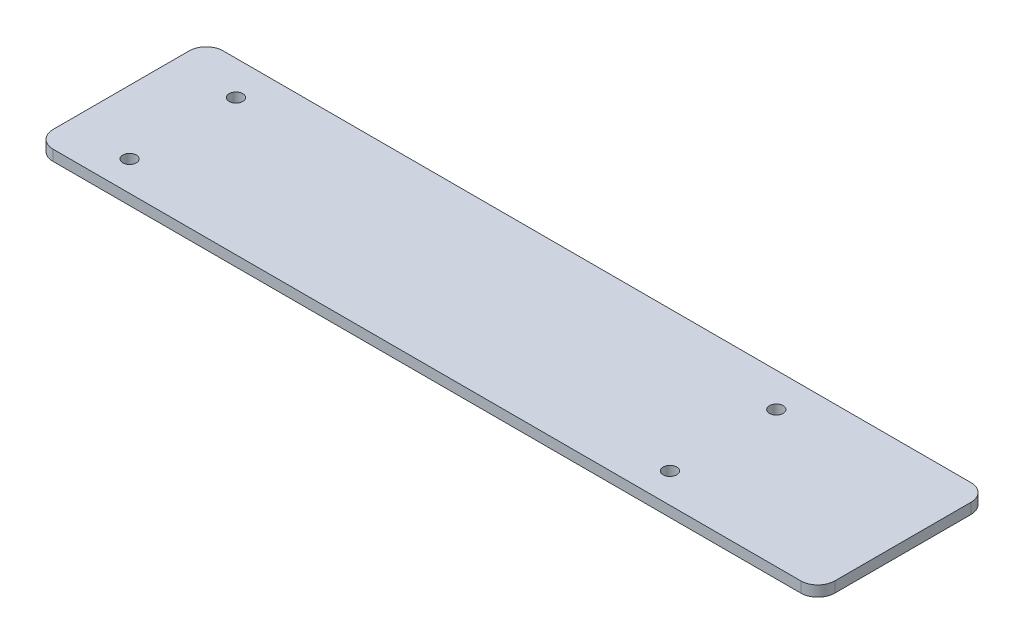
from build123d import *

# Parameters (mm, degrees)
SKETCH2_W           = 233.3625
SKETCH2_H           = 50.8
SKETCH2_R           = 2.032
BOSS_EXTRUDE1_DEPTH = 3.175
FILLET1_R           = 5.08


with BuildPart() as part:
    # Sketch2 → Boss-Extrude1 (new body)
    with BuildSketch(Plane(origin=(0, 0, 0), x_dir=(1, 0, 0), z_dir=(0, 1, 0))):
        Rectangle(SKETCH2_W, SKETCH2_H)
        with Locations(Location((-97.63125, 15.24, 0), (0, 0, 270))):
            Circle(SKETCH2_R, mode=Mode.SUBTRACT)
        with Locations(Location((-97.63125, -16.51, 0), (0, 0, 270))):
            Circle(SKETCH2_R, mode=Mode.SUBTRACT)
        with Locations(Location((63.65875, -16.51, 0), (0, 0, 270))):
            Circle(SKETCH2_R, mode=Mode.SUBTRACT)
        with Locations(Location((63.65875, 15.24, 0), (0, 0, 270))):
            Circle(SKETCH2_R, mode=Mode.SUBTRACT)
    extrude(amount=BOSS_EXTRUDE1_DEPTH)

    # Fillet1
    fillet1_edges = [part.edges().sort_by_distance(p)[0] for p in [
        (116.68125, 1.5875, 25.4),
        (-116.68125, 1.5875, 25.4),
        (-116.68125, 1.5875, -25.4),
        (116.68125, 1.5875, -25.4),
    ]]
    fillet(fillet1_edges, radius=FILLET1_R)


solid = part.part
